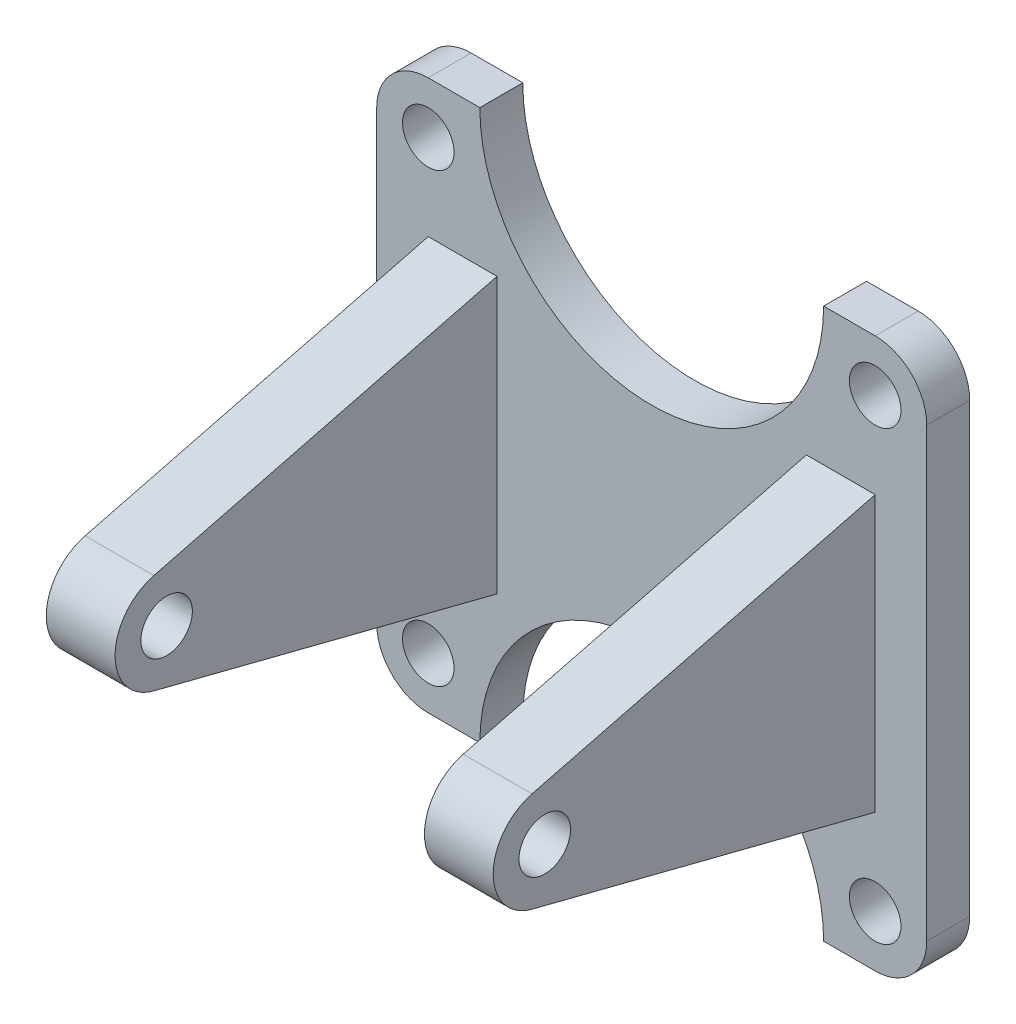
from build123d import *

# Parameters (mm, degrees)
SKETCH_1_W          = 4
SKETCH_1_H          = 16
EXTRUDE_1_DEPTH     = 25
EXTRUDE_1_2_DEPTH   = 25
SKETCH_1_4_R        = 1.5
SKETCH_1_4_W        = 4
SKETCH_1_4_H        = 16
EXTRUDE_2_DEPTH     = 2.5
SKETCH_5_R          = 1.5
CUT_EXTRUDE_1_DEPTH = 42.496987842


with BuildPart() as part:
    # 草图1 → 凸台-拉伸1 (new body)
    with BuildSketch(Plane.XY):
        with Locations((-11, 0)):
            Rectangle(SKETCH_1_W, SKETCH_1_H)
    extrude(amount=EXTRUDE_1_DEPTH)



with BuildPart() as body_2:
    # 草图1 → Extrude 1 2 (new body)
    with BuildSketch(Plane.XY):
        with Locations((11, 0)):
            Rectangle(SKETCH_1_W, SKETCH_1_H)
    extrude(amount=EXTRUDE_1_2_DEPTH)


with BuildPart() as part_1:
    add(part.part)

    add(body_2.part)  # 凸台-拉伸2 merges body 2
    # 草图1<4> → 凸台-拉伸2 (add)
    with BuildSketch(Plane.XY):
        with BuildLine():
            ThreePointArc((-10, -16), (0, -6), (10, -16))
            Line((10, -16), (13, -16))
            ThreePointArc((13, -16), (15.121320344, -15.121320344), (16, -13))
            Line((16, -13), (16, 13))
            ThreePointArc((16, 13), (15.121320344, 15.121320344), (13, 16))
            Line((13, 16), (10, 16))
            ThreePointArc((10, 16), (0, 6), (-10, 16))
            Line((-10, 16), (-13, 16))
            ThreePointArc((-13, 16), (-15.121320344, 15.121320344), (-16, 13))
            Line((-16, 13), (-16, -13))
            ThreePointArc((-16, -13), (-15.121320344, -15.121320344), (-13, -16))
            Line((-13, -16), (-10, -16))
        make_face()
        with Locations((-13, 13)):
            Circle(SKETCH_1_4_R, mode=Mode.SUBTRACT)
        with Locations((-11, 0)):
            Rectangle(SKETCH_1_4_W, SKETCH_1_4_H, mode=Mode.SUBTRACT)
        with Locations((-13, -13)):
            Circle(SKETCH_1_4_R, mode=Mode.SUBTRACT)
        with Locations((13, 13)):
            Circle(SKETCH_1_4_R, mode=Mode.SUBTRACT)
        with Locations((11, 0)):
            Rectangle(SKETCH_1_4_W, SKETCH_1_4_H, mode=Mode.SUBTRACT)
        with Locations((13, -13)):
            Circle(SKETCH_1_4_R, mode=Mode.SUBTRACT)
    extrude(amount=EXTRUDE_2_DEPTH)

    # 草图5 → 切除-拉伸1 (cut, through all)
    with BuildSketch(Plane.ZY.offset(13)):
        with BuildLine():
            Line((25, 8), (2.5, 8))
            Line((2.5, 8), (22.464054272, 2.90689625))
            ThreePointArc((22.464054272, 2.90689625), (24.722465308, 4.2e-08), (22.464054353, -2.906896229))
            Line((22.464054353, -2.906896229), (2.5, -8))
            Line((2.5, -8), (25, -8))
            Line((25, -8), (25, 8))
        make_face()
        with Locations((21.722465308, 0)):
            Circle(SKETCH_5_R)
    extrude(amount=-CUT_EXTRUDE_1_DEPTH, mode=Mode.SUBTRACT)


solid = part_1.part
